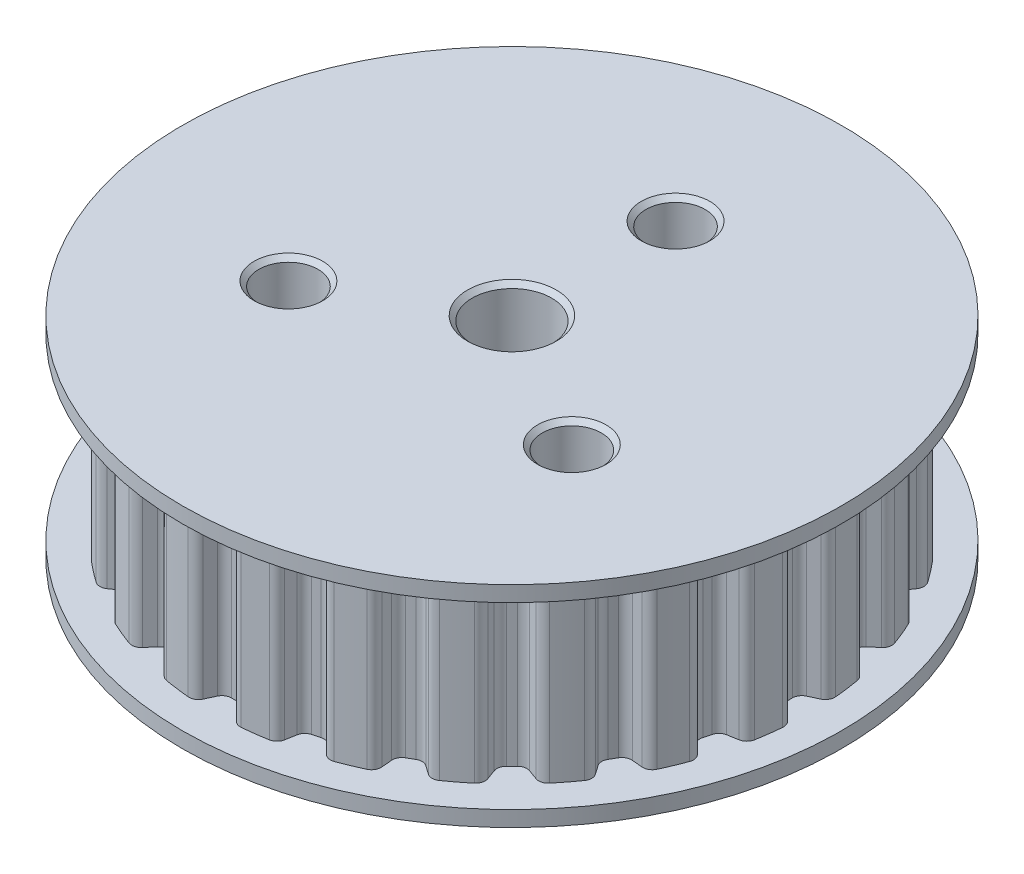
from build123d import *

# Parameters (mm, degrees)
SKETCH3_R                = 17.75
BOSS_EXTRUDE1_DEPTH      = 5.75
BOSS_EXTRUDE2_DEPTH      = 5.75
FILLET1_R                = 0.61
FILLET2_R                = 0.61
CIRPATTERN1_COUNT        = 24
FILLET1_OF_CIRPATTERN1_R = 0.61
FILLET2_OF_CIRPATTERN1_R = 0.61
SKETCH4_R                = 21.15
BOSS_EXTRUDE3_DEPTH      = 1
CUT_EXTRUDE1_DEPTH       = 33.816078376
CUT_EXTRUDE1_DEPTH_BACK  = 33.816078376
SKETCH5_R                = 2.55
SKETCH5_R_2              = 1.9
CHAMFER2_SIZE            = 0.3
SKETCH6_R                = 15
CUT_EXTRUDE2_DEPTH       = 3.4


with BuildPart() as part:
    # Sketch3 → Boss-Extrude1 (new, symmetric)
    with BuildSketch(Plane(origin=(0, 0, 0), x_dir=(1, 0, 0), z_dir=(0, 1, 0))):
        with Locations(Location((0, 0, 0), (0, 0, 270))):
            Circle(SKETCH3_R)
    extrude(amount=BOSS_EXTRUDE1_DEPTH, both=True)

    # Sketch2 → Boss-Extrude2 (add, symmetric)
    with BuildSketch(Plane(origin=(0, 0, 0), x_dir=(1, 0, 0), z_dir=(0, 1, 0))):
        with BuildLine():
            ThreePointArc((3.977866506, 17.298528205), (2.316839912, 17.598146289), (0.63486456, 17.738642761))
            Line((0.63486456, 17.738642761), (1.273232037, 19.107626231))
            ThreePointArc((1.273232037, 19.107626231), (2.499576581, 18.986169095), (3.715569868, 18.786086355))
            Line((3.715569868, 18.786086355), (3.977866506, 17.298528205))
        make_face()
    boss_extrude2 = extrude(amount=BOSS_EXTRUDE2_DEPTH, both=True)

    # Fillet1
    fillet1_edges = [part.edges().sort_by_distance(p)[0] for p in [
        (0.63486456, 0, -17.738642761),
        (3.977866506, 0, -17.298528205),
    ]]
    fillet(fillet1_edges, radius=FILLET1_R)

    # Fillet2
    fillet2_edges = [part.edges().sort_by_distance(p)[0] for p in [
        (3.715569868, 0, -18.786086355),
        (1.273232037, 0, -19.107626231),
    ]]
    fillet(fillet2_edges, radius=FILLET2_R)

    # CirPattern1: Boss-Extrude2 ×24 about axis
    cirpattern1_axis = Axis((0, 0, 0), (0, 1, 0))
    for i in range(1, CIRPATTERN1_COUNT):
        add(boss_extrude2.rotate(cirpattern1_axis, i * 360 / CIRPATTERN1_COUNT))

    # Fillet1 of CirPattern1
    fillet1_of_cirpattern1_edges = [part.edges().sort_by_distance(p)[0] for p in [
        (-3.977866506, 0, -17.298528205),
        (-0.63486456, 0, -17.738642761),
        (-8.319512543, 0, -15.67954754),
        (-5.204330656, 0, -16.969898127),
        (-12.094197549, 0, -12.992031621),
        (-9.419130218, 0, -15.044682979),
        (-15.044682979, 0, -9.419130218),
        (-12.992031621, 0, -12.094197549),
        (-16.969898127, 0, -5.204330656),
        (-15.67954754, 0, -8.319512543),
        (-17.738642761, 0, -0.63486456),
        (-17.298528205, 0, -3.977866506),
        (-17.298528205, 0, 3.977866506),
        (-17.738642761, 0, 0.63486456),
        (-15.67954754, 0, 8.319512543),
        (-16.969898127, 0, 5.204330656),
        (-12.992031621, 0, 12.094197549),
        (-15.044682979, 0, 9.419130218),
        (-9.419130218, 0, 15.044682979),
        (-12.094197549, 0, 12.992031621),
        (-5.204330656, 0, 16.969898127),
        (-8.319512543, 0, 15.67954754),
        (-0.63486456, 0, 17.738642761),
        (-3.977866506, 0, 17.298528205),
        (3.977866506, 0, 17.298528205),
        (0.63486456, 0, 17.738642761),
        (8.319512543, 0, 15.67954754),
        (5.204330656, 0, 16.969898127),
        (12.094197549, 0, 12.992031621),
        (9.419130218, 0, 15.044682979),
        (15.044682979, 0, 9.419130218),
        (12.992031621, 0, 12.094197549),
        (16.969898127, 0, 5.204330656),
        (15.67954754, 0, 8.319512543),
        (17.738642761, 0, 0.63486456),
        (17.298528205, 0, 3.977866506),
        (17.298528205, 0, -3.977866506),
        (17.738642761, 0, -0.63486456),
        (15.67954754, 0, -8.319512543),
        (16.969898127, 0, -5.204330656),
        (12.992031621, 0, -12.094197549),
        (15.044682979, 0, -9.419130218),
        (9.419130218, 0, -15.044682979),
        (12.094197549, 0, -12.992031621),
        (5.204330656, 0, -16.969898127),
        (8.319512543, 0, -15.67954754),
    ]]
    fillet(fillet1_of_cirpattern1_edges, radius=FILLET1_OF_CIRPATTERN1_R)

    # Fillet2 of CirPattern1
    fillet2_of_cirpattern1_edges = [part.edges().sort_by_distance(p)[0] for p in [
        (-1.273232037, 0, -19.107626231),
        (-3.715569868, 0, -18.786086355),
        (-6.175265282, 0, -18.127012956),
        (-8.451161827, 0, -17.18430574),
        (-10.656464404, 0, -15.911073704),
        (-12.610821073, 0, -14.411443087),
        (-14.411443087, 0, -12.610821073),
        (-15.911073704, 0, -10.656464404),
        (-17.18430574, 0, -8.451161827),
        (-18.127012956, 0, -6.175265282),
        (-18.786086355, 0, -3.715569868),
        (-19.107626231, 0, -1.273232037),
        (-19.107626231, 0, 1.273232037),
        (-18.786086355, 0, 3.715569868),
        (-18.127012956, 0, 6.175265282),
        (-17.18430574, 0, 8.451161827),
        (-15.911073704, 0, 10.656464404),
        (-14.411443087, 0, 12.610821073),
        (-12.610821073, 0, 14.411443087),
        (-10.656464404, 0, 15.911073704),
        (-8.451161827, 0, 17.18430574),
        (-6.175265282, 0, 18.127012956),
        (-3.715569868, 0, 18.786086355),
        (-1.273232037, 0, 19.107626231),
        (1.273232037, 0, 19.107626231),
        (3.715569868, 0, 18.786086355),
        (6.175265282, 0, 18.127012956),
        (8.451161827, 0, 17.18430574),
        (10.656464404, 0, 15.911073704),
        (12.610821073, 0, 14.411443087),
        (14.411443087, 0, 12.610821073),
        (15.911073704, 0, 10.656464404),
        (17.18430574, 0, 8.451161827),
        (18.127012956, 0, 6.175265282),
        (18.786086355, 0, 3.715569868),
        (19.107626231, 0, 1.273232037),
        (19.107626231, 0, -1.273232037),
        (18.786086355, 0, -3.715569868),
        (18.127012956, 0, -6.175265282),
        (17.18430574, 0, -8.451161827),
        (15.911073704, 0, -10.656464404),
        (14.411443087, 0, -12.610821073),
        (12.610821073, 0, -14.411443087),
        (10.656464404, 0, -15.911073704),
        (8.451161827, 0, -17.18430574),
        (6.175265282, 0, -18.127012956),
    ]]
    fillet(fillet2_of_cirpattern1_edges, radius=FILLET2_OF_CIRPATTERN1_R)

    # Sketch4 → Boss-Extrude3 (add)
    with BuildSketch(Plane(origin=(0, 5.75, 0), x_dir=(1, 0, 0), z_dir=(0, 1, 0))):
        with Locations(Location((0, 0, 0), (0, 0, 270))):
            Circle(SKETCH4_R)
    boss_extrude3 = extrude(amount=BOSS_EXTRUDE3_DEPTH)

    # Mirror1: Boss-Extrude3 across plane
    add(boss_extrude3.mirror(Plane.ZX))

    # Sketch5 → Cut-Extrude1 (cut, two sides: drawn at the far end of the back side and taken through both)
    with BuildSketch(Plane(origin=(0, 6.75, 0), x_dir=(1, 0, 0), z_dir=(0, 1, 0)).offset(-CUT_EXTRUDE1_DEPTH_BACK)):
        with Locations(Location((0, 0, 0), (0, 0, 270))):
            Circle(SKETCH5_R)
        with Locations(Location((0, 10.5, 0), (0, 0, 270))):
            Circle(SKETCH5_R_2)
        with Locations(Location((9.09326674, -5.25, 0), (0, 0, 270))):
            Circle(SKETCH5_R_2)
        with Locations(Location((-9.09326674, -5.25, 0), (0, 0, 270))):
            Circle(SKETCH5_R_2)
    extrude(amount=CUT_EXTRUDE1_DEPTH + CUT_EXTRUDE1_DEPTH_BACK, mode=Mode.SUBTRACT)

    # Chamfer2
    chamfer2_edges = [part.edges().sort_by_distance(p)[0] for p in [
        (-9.09326674, 6.75, 3.35),
        (-9.09326674, -6.75, 3.35),
        (9.09326674, 6.75, 3.35),
        (9.09326674, -6.75, 3.35),
        (0, 6.75, -12.4),
        (0, -6.75, -12.4),
        (0, 6.75, -2.55),
        (0, -6.75, -2.55),
    ]]
    chamfer(chamfer2_edges, length=CHAMFER2_SIZE)

    # Sketch6 → Cut-Extrude2 (cut)
    with BuildSketch(Plane.XZ.offset(6.75)):
        with Locations(Location((0, 0, 0), (0, 0, 270))):
            Circle(SKETCH6_R)
    extrude(amount=-CUT_EXTRUDE2_DEPTH, mode=Mode.SUBTRACT)


solid = part.part
